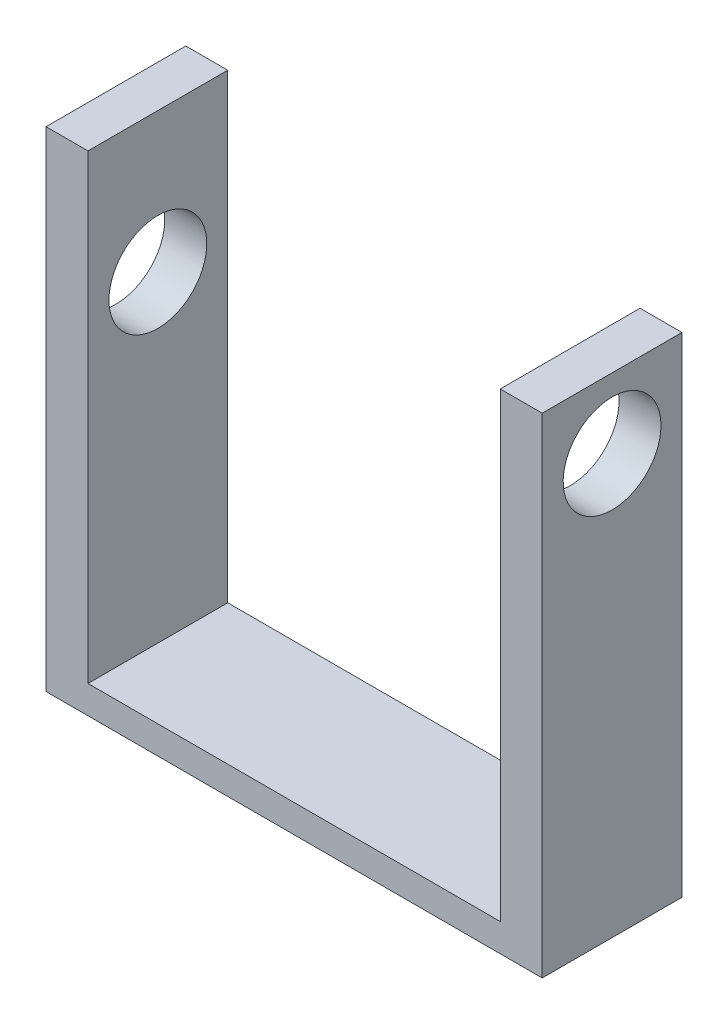
from build123d import *

# Parameters (mm, degrees)
BOSS_EXTRUDE1_DEPTH = 5
SKETCH2_R           = 3.5
CUT_EXTRUDE1_DEPTH  = 5
CUT_EXTRUDE2_REACH  = 52.102
SKETCH3_R           = 3.5


with BuildPart() as part:
    # Sketch1 → Boss-Extrude1 (new, symmetric)
    with BuildSketch(Plane.XY):
        Polygon((14.75, 2), (-14.75, 2), (-14.75, 35), (-17.75, 35), (-17.75, 0), (17.75, 0), (17.75, 35), (14.75, 35), align=None)
    extrude(amount=BOSS_EXTRUDE1_DEPTH, both=True)

    # Sketch2 → Cut-Extrude1 (cut, symmetric)
    with BuildSketch(Plane(origin=(17.75, 0, 0), x_dir=(0, 0, -1), z_dir=(1, 0, 0))):
        with Locations((0, 30)):
            Circle(SKETCH2_R)
    extrude(amount=CUT_EXTRUDE1_DEPTH, both=True, mode=Mode.SUBTRACT)

    # Sketch3 → Cut-Extrude2 (cut, up to next)
    with BuildSketch(Plane.ZY.offset(17.75), mode=Mode.PRIVATE) as cut_extrude2_sk1:
        with Locations((0, 25)):
            Circle(SKETCH3_R)
    cut_extrude2_tool1 = extrude(cut_extrude2_sk1.sketch, amount=-CUT_EXTRUDE2_REACH, mode=Mode.PRIVATE) & part.part
    add(cut_extrude2_tool1.solids().sort_by_distance((-17.75, 25, 0))[0], mode=Mode.SUBTRACT)


solid = part.part
